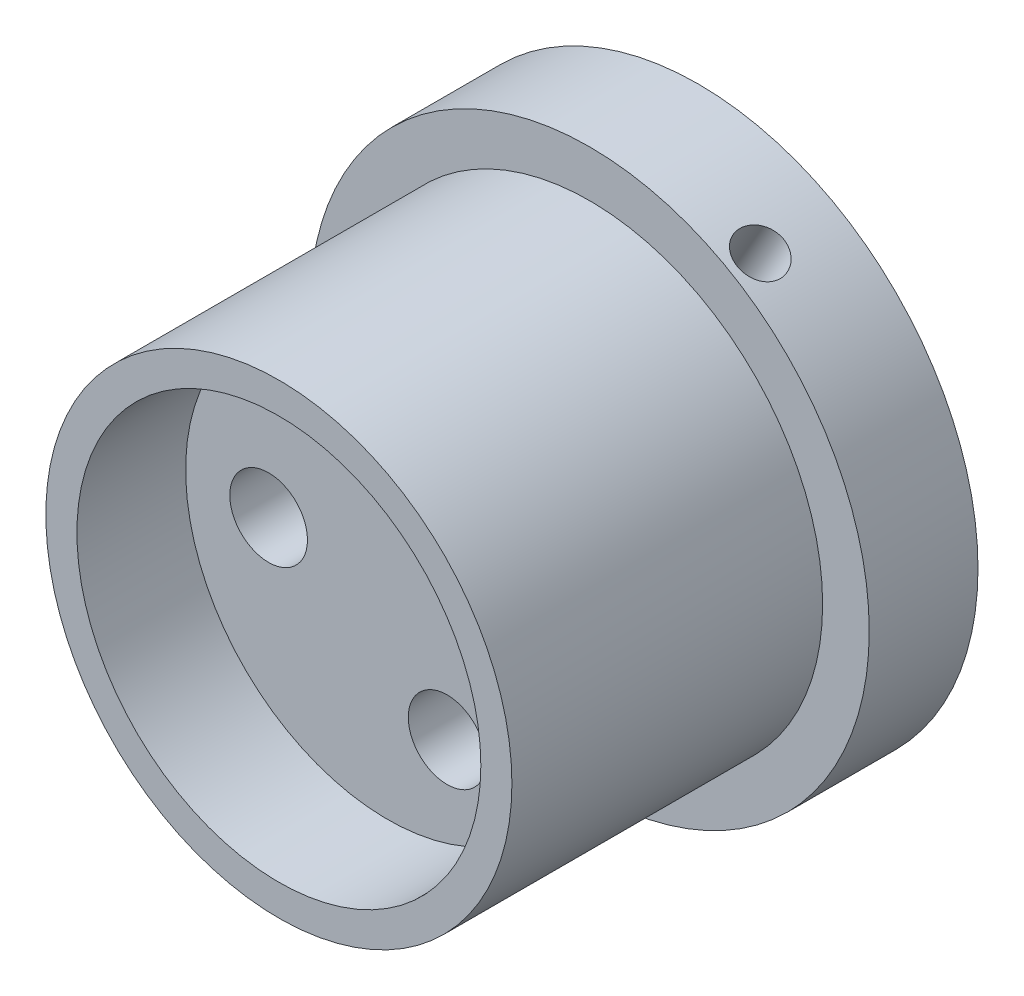
from build123d import *

# Parameters (mm, degrees)
SKETCH1_R                = 15
BOSS_EXTRUDE1_DEPTH      = 20
SKETCH2_R                = 10.95
BOSS_EXTRUDE2_DEPTH      = 3.5
SKETCH4_R                = 3.05
CUT_EXTRUDE1_DEPTH       = 4.1
SKETCH5_R                = 1.5
CUT_EXTRUDE2_DEPTH       = 4
SKETCH7_R                = 10.95
SKETCH7_R_2              = 3
BOSS_EXTRUDE3_DEPTH      = 11
SKETCH9_R                = 1.5
CUT_EXTRUDE4_DEPTH       = 41.5
BOSS_EXTRUDE4_START      = 7
SKETCH12_R               = 18
SKETCH12_R_2             = 3.25
SKETCH12_R_3             = 3.05
BOSS_EXTRUDE4_DEPTH      = 7
CUT_EXTRUDE9_START       = -5
SKETCH13_R               = 1.5
CUT_EXTRUDE9_DEPTH       = 17
CIRPATTERN1_COUNT        = 3
CUT_EXTRUDE12_DEPTH      = 15
CUT_EXTRUDE12_DEPTH_BACK = 38.1079508
SKETCH15_R               = 13
SKETCH15_R_2             = 10.95
BOSS_EXTRUDE6_START      = 13
SKETCH17_R               = 13
BOSS_EXTRUDE6_DEPTH      = 20
SKETCH19_R               = 2.5
CUT_EXTRUDE13_DEPTH      = 38.107950728


with BuildPart() as part:
    # Sketch1 → Boss-Extrude1 (new body)
    with BuildSketch(Plane.XY):
        Circle(SKETCH1_R)
    extrude(amount=BOSS_EXTRUDE1_DEPTH)

    # Sketch2 → Boss-Extrude2 (add)
    with BuildSketch(Plane.XY.offset(20)):
        Circle(SKETCH2_R)
    extrude(amount=BOSS_EXTRUDE2_DEPTH)

    # Sketch4 → Cut-Extrude1 (cut)
    with BuildSketch(Plane(origin=(0, 0, 0), x_dir=(-1, 0, 0), z_dir=(0, 0, -1))):
        Circle(SKETCH4_R)
    extrude(amount=-CUT_EXTRUDE1_DEPTH, mode=Mode.SUBTRACT)

    # Sketch5 → Cut-Extrude2 (cut)
    with BuildSketch(Plane(origin=(0, 0, 4.1), x_dir=(-1, 0, 0), z_dir=(0, 0, -1))):
        Circle(SKETCH5_R)
    extrude(amount=-CUT_EXTRUDE2_DEPTH, mode=Mode.SUBTRACT)

    # Sketch7 → Boss-Extrude3 (add)
    with BuildSketch(Plane.XY.offset(23.5)):
        Circle(SKETCH7_R)
        Circle(SKETCH7_R_2, mode=Mode.SUBTRACT)
    extrude(amount=BOSS_EXTRUDE3_DEPTH)

    # Sketch9 → Cut-Extrude4 (cut, through all)
    with BuildSketch(Plane.XY.offset(34.5)):
        with Locations((7, 0)):
            Circle(SKETCH9_R)
        with Locations((-3.5, -6.062177826)):
            Circle(SKETCH9_R)
        with Locations((-3.5, 6.062177826)):
            Circle(SKETCH9_R)
    extrude(amount=-CUT_EXTRUDE4_DEPTH, mode=Mode.SUBTRACT)

    # Sketch12 → Boss-Extrude4 (add)
    with BuildSketch(Plane(origin=(0, 0, 0), x_dir=(-1, 0, 0), z_dir=(0, 0, -1)).offset(BOSS_EXTRUDE4_START)):
        Circle(SKETCH12_R)
        with Locations((3.5, 6.062177826)):
            Circle(SKETCH12_R_2, mode=Mode.SUBTRACT)
        with Locations((3.5, -6.062177826)):
            Circle(SKETCH12_R_2, mode=Mode.SUBTRACT)
        with Locations((-7, 0)):
            Circle(SKETCH12_R_2, mode=Mode.SUBTRACT)
        Circle(SKETCH12_R_3, mode=Mode.SUBTRACT)
    extrude(amount=-BOSS_EXTRUDE4_DEPTH)

    # Sketch13 → Cut-Extrude9 (cut)
    with BuildSketch(Plane(origin=(0, 0, 0), x_dir=(0, 0, -1), z_dir=(1, 0, 0)).offset(CUT_EXTRUDE9_START)):
        with Locations((2, 0)):
            Circle(SKETCH13_R)
    cut_extrude9 = extrude(amount=-CUT_EXTRUDE9_DEPTH, mode=Mode.SUBTRACT)

    # CirPattern1: Cut-Extrude9 ×3 about axis
    cirpattern1_axis = Axis((0, 0, 0), (0, 0, 1))
    for i in range(1, CIRPATTERN1_COUNT):
        add(cut_extrude9.rotate(cirpattern1_axis, i * 360 / CIRPATTERN1_COUNT), mode=Mode.SUBTRACT)

    # Sketch15 → Cut-Extrude12 (cut, two sides: drawn at the far end of the back side and taken through both)
    # profile 1 of 2: a face of its own
    with BuildSketch(Plane.XY.offset(20).offset(-CUT_EXTRUDE12_DEPTH_BACK)):
        Circle(SKETCH15_R)
        Circle(SKETCH15_R_2, mode=Mode.SUBTRACT)
    # profile 2 of 2: a face of its own
    with BuildSketch(Plane.XY.offset(20).offset(-CUT_EXTRUDE12_DEPTH_BACK)):
        Circle(SKETCH15_R_2)
    extrude(amount=CUT_EXTRUDE12_DEPTH + CUT_EXTRUDE12_DEPTH_BACK, mode=Mode.SUBTRACT)

    # Sketch17 → Boss-Extrude6 (add)
    with BuildSketch(Plane.XY.offset(BOSS_EXTRUDE6_START)):
        Circle(SKETCH17_R)
    extrude(amount=-BOSS_EXTRUDE6_DEPTH)

    # Sketch19 → Cut-Extrude13 (cut, through all)
    with BuildSketch(Plane(origin=(0, 0, -7), x_dir=(-1, 0, 0), z_dir=(0, 0, -1))):
        with Locations((7.66, 0)):
            Circle(SKETCH19_R)
        with Locations((-3.83, -6.633754593)):
            Circle(SKETCH19_R)
        with Locations((-3.83, 6.633754593)):
            Circle(SKETCH19_R)
    extrude(amount=-CUT_EXTRUDE13_DEPTH, mode=Mode.SUBTRACT)


solid = part.part
